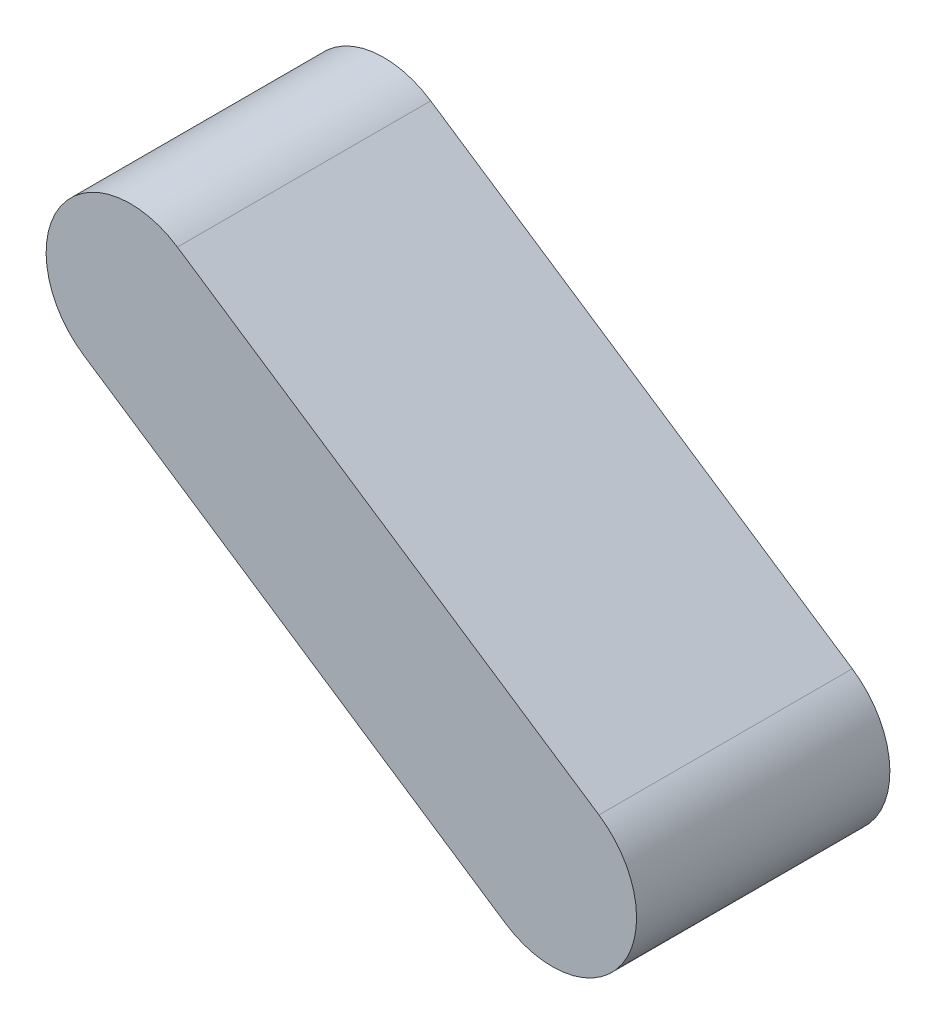
from build123d import *

# Parameters (mm, degrees)
EXTRUDE_1_DEPTH = 15


with BuildPart() as part:
    # 草图2 → 凸台-拉伸1 (new, symmetric)
    with BuildSketch(Plane.XY):
        with BuildLine():
            Line((-5.546347385, -8.320939291), (-55.47198313, 24.957145021))
            ThreePointArc((-55.47198313, 24.957145021), (-58.246575036, 38.824431697), (-44.37928836, 41.599023602))
            Line((-44.37928836, 41.599023602), (5.546347385, 8.320939291))
            ThreePointArc((5.546347385, 8.320939291), (8.320939291, -5.546347385), (-5.546347385, -8.320939291))
        make_face()
    extrude(amount=EXTRUDE_1_DEPTH, both=True)


solid = part.part
